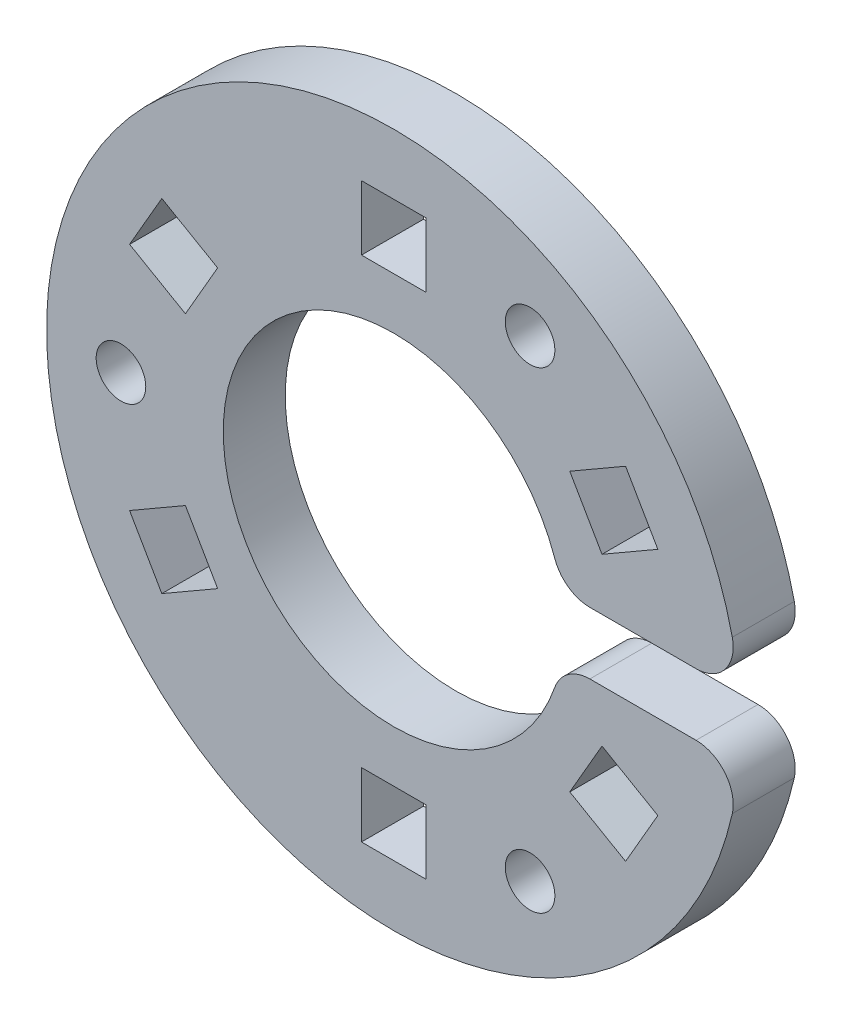
from build123d import *

# Parameters (mm, degrees)
SKETCH1_R           = 2
SKETCH1_W           = 5.2
SKETCH1_H           = 5.2
BOSS_EXTRUDE1_DEPTH = 5
CONG_2_R            = 3


with BuildPart() as part:
    # Sketch1 → Boss-Extrude1 (new body)
    with BuildSketch(Plane.XY):
        with BuildLine():
            Line((27.888169535, 2.5), (13.520817283, 2.5))
            ThreePointArc((13.520817283, 2.5), (-13.75, 0), (13.520817283, -2.5))
            Line((13.520817283, -2.5), (27.888169535, -2.5))
            ThreePointArc((27.888169535, -2.5), (-28, 0), (27.888169535, 2.5))
        make_face()
        with Locations((11, 19.052558883)):
            Circle(SKETCH1_R, mode=Mode.SUBTRACT)
        with Locations((11, -19.052558883)):
            Circle(SKETCH1_R, mode=Mode.SUBTRACT)
        with Locations((-22, 0)):
            Circle(SKETCH1_R, mode=Mode.SUBTRACT)
        with Locations((0, 20.5)):
            Rectangle(SKETCH1_W, SKETCH1_H, mode=Mode.SUBTRACT)
        Polygon((21.305186827, 9.29833395), (16.801854728, 6.69833395), (14.201854728, 11.20166605), (18.705186827, 13.80166605), align=None, mode=Mode.SUBTRACT)
        Polygon((18.705186827, -13.80166605), (14.201854728, -11.20166605), (16.801854728, -6.69833395), (21.305186827, -9.29833395), align=None, mode=Mode.SUBTRACT)
        with Locations((0, -20.5)):
            Rectangle(SKETCH1_W, SKETCH1_H, mode=Mode.SUBTRACT)
        Polygon((-21.305186827, -9.29833395), (-16.801854728, -6.69833395), (-14.201854728, -11.20166605), (-18.705186827, -13.80166605), align=None, mode=Mode.SUBTRACT)
        Polygon((-18.705186827, 13.80166605), (-14.201854728, 11.20166605), (-16.801854728, 6.69833395), (-21.305186827, 9.29833395), align=None, mode=Mode.SUBTRACT)
    extrude(amount=BOSS_EXTRUDE1_DEPTH)

    # Congé2
    cong_2_edges = [part.edges().sort_by_distance(p)[0] for p in [
        (27.888169535, 2.5, 2.5),
        (13.520817283, 2.5, 2.5),
        (13.520817283, -2.5, 2.5),
        (27.888169535, -2.5, 2.5),
    ]]
    fillet(cong_2_edges, radius=CONG_2_R)


solid = part.part
